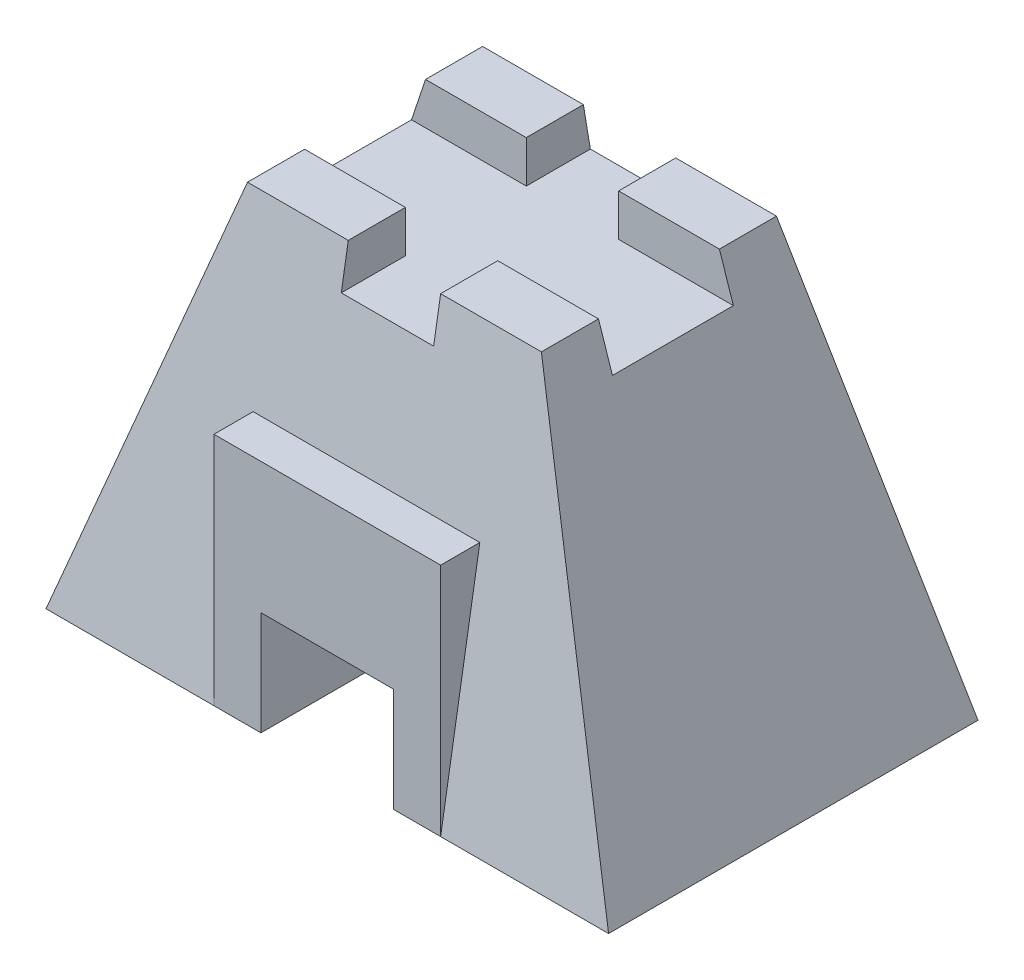
from build123d import *

# Parameters (mm, degrees)
CORTAR_EXTRUIR3_DEPTH   = 31.75
SALIENTE_EXTRUIR1_DEPTH = 48.26
SALIENTE_EXTRUIR2_START = -29.633333
CROQUIS7_W              = 171.45
CROQUIS7_H              = 177.8
SALIENTE_EXTRUIR2_DEPTH = 29.633333
CORTAR_EXTRUIR4_REACH   = 466.994
CROQUIS8_W              = 100.33
CROQUIS8_H              = 78.74


with BuildPart() as part:
    # Croquis2 → Recubrir1 section 0
    with BuildSketch(Plane(origin=(0, 0, 0), x_dir=(1, 0, 0), z_dir=(0, 1, 0))):
        with BuildLine():
            Line((212.725, -139.7), (-212.725, -139.7))
            Line((-212.725, -139.7), (-212.725, 139.7))
            Line((-212.725, 139.7), (212.725, 139.7))
            Line((212.725, 139.7), (212.725, -139.7))
        make_face()
    # Croquis3 → Recubrir1 section 1
    with BuildSketch(Plane(origin=(0, 304.8, 0), x_dir=(1, 0, 0), z_dir=(0, 1, 0))):
        with BuildLine():
            Line((111.125, -88.9), (-111.125, -88.9))
            Line((-111.125, -88.9), (-111.125, 88.9))
            Line((-111.125, 88.9), (111.125, 88.9))
            Line((111.125, 88.9), (111.125, -88.9))
        make_face()
    loft()

    # Croquis5 → Cortar-Extruir3 (cut)
    with BuildSketch(Plane(origin=(0, 304.8, 0), x_dir=(1, 0, 0), z_dir=(0, 1, 0))):
        Polygon((171.921254814, -45.72), (34.925, -45.72), (34.925, -107.229562049), (-34.925, -107.229562049), (-34.925, -45.72), (-171.921254814, -45.72), (-171.921254814, 45.72), (-34.925, 45.72), (-34.925, 107.229562049), (34.925, 107.229562049), (34.925, 45.72), (171.921254814, 45.72), align=None)
    extrude(amount=-CORTAR_EXTRUIR3_DEPTH, mode=Mode.SUBTRACT)

    # Croquis6 → Saliente-Extruir1 (add)
    with BuildSketch(Plane(origin=(-212.725, 0, 0), x_dir=(0, 0, -1), z_dir=(1, 0, 0))):
        Polygon((139.7, 0), (0, 144.78), (-139.7, 0), align=None)
    extrude(amount=SALIENTE_EXTRUIR1_DEPTH)

    # Croquis7 → Saliente-Extruir2 (add)
    with BuildSketch(Plane.XY.offset(139.7).offset(SALIENTE_EXTRUIR2_START)):
        with Locations((0, 88.9)):
            Rectangle(CROQUIS7_W, CROQUIS7_H)
    extrude(amount=SALIENTE_EXTRUIR2_DEPTH)

    # Cortar-Extruir4: up to this plane
    cortar_extruir4_end = Plane(origin=(0, 22.654054054, -135.924324324), z_dir=(0, -0.16439898730535737, 0.9863939238321437))
    # Croquis8 → Cortar-Extruir4 (cut, up to the surface)
    with BuildSketch(Plane.XY.offset(139.7), mode=Mode.PRIVATE) as cortar_extruir4_sk1:
        with Locations((0, 39.37)):
            Rectangle(CROQUIS8_W, CROQUIS8_H)
    cortar_extruir4_tool1 = split(extrude(cortar_extruir4_sk1.sketch, amount=-CORTAR_EXTRUIR4_REACH, mode=Mode.PRIVATE), bisect_by=cortar_extruir4_end, keep=Keep.BOTH, mode=Mode.PRIVATE)
    add(cortar_extruir4_tool1.solids().sort_by_distance((0, 39.37, 139.7))[0], mode=Mode.SUBTRACT)


solid = part.part
